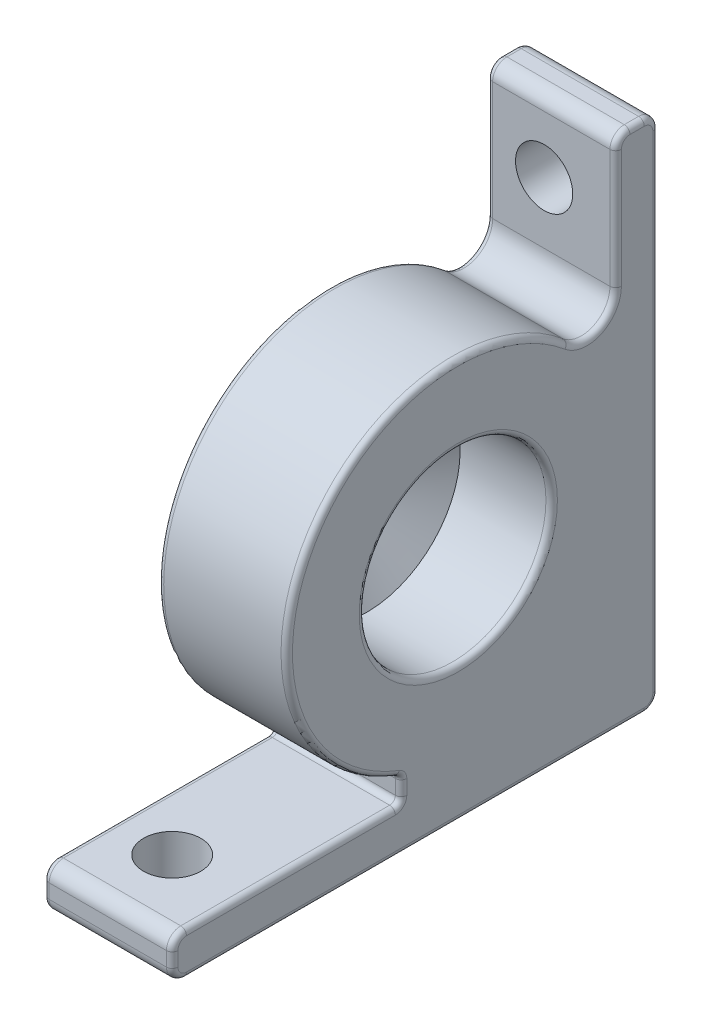
from build123d import *

# Parameters (mm, degrees)
EXTRUDE_1_DEPTH             = 4.5
SKETCH_2_R                  = 2
CUT_EXTRUDE_1_DEPTH         = 10
HOLE_WIZARD_5_16_18_1_D     = 6.5278
HOLE_WIZARD_5_16_18_1_DEPTH = 3.2
HOLE_WIZARD_5_16_18_1_TIP   = 1.961148974
CUT_EXTRUDE_2_REACH         = 21.812
SKETCH_5_R                  = 1
CUT_EXTRUDE_3_REACH         = 20.987
SKETCH_6_R                  = 1
FILLET_1_R                  = 0.2


with BuildPart() as part:
    # 草图1 → 凸台-拉伸1 (new body)
    with BuildSketch(Plane(origin=(0, 0, 0), x_dir=(0, 0, -1), z_dir=(1, 0, 0))):
        with BuildLine():
            Line((-9.5, -6.5), (-2.2, -6.5))
            ThreePointArc((-2.2, -6.5), (-2.058578644, -6.441421356), (-2, -6.3))
            Line((-2, -6.3), (-2, -5.791869158))
            ThreePointArc((-2, -5.791869158), (-2.035373795, -5.67829886), (-2.128982125, -5.604902686))
            ThreePointArc((-2.128982125, -5.604902686), (-5.170400988, 3.035531689), (3.856740666, 4.590539233))
            ThreePointArc((3.856740666, 4.590539233), (4.922339121, 4.449749704), (5.5, 5.356187605))
            Line((5.5, 5.356187605), (5.5, 9.5))
            ThreePointArc((5.5, 9.5), (5.646446609, 9.853553391), (6, 10))
            Line((6, 10), (6.5, 10))
            ThreePointArc((6.5, 10), (6.853553391, 9.853553391), (7, 9.5))
            Line((7, 9.5), (7, -7.5))
            ThreePointArc((7, -7.5), (6.853553391, -7.853553391), (6.5, -8))
            Line((6.5, -8), (-9.5, -8))
            ThreePointArc((-9.5, -8), (-9.853553391, -7.853553391), (-10, -7.5))
            Line((-10, -7.5), (-10, -7))
            ThreePointArc((-10, -7), (-9.853553391, -6.646446609), (-9.5, -6.5))
        make_face()
    extrude(amount=EXTRUDE_1_DEPTH)

    # 草图2 → 切除-拉伸1 (cut)
    with BuildSketch(Plane.ZY):
        Circle(SKETCH_2_R)
    extrude(amount=-CUT_EXTRUDE_1_DEPTH, mode=Mode.SUBTRACT)

    # 5/16-18 螺纹孔1
    with Locations(Plane(origin=(4.5, 0, 0), x_dir=(0, 0, -1), z_dir=(1, 0, 0))):
        with Locations((0, 0)):
            Hole(HOLE_WIZARD_5_16_18_1_D / 2, depth=HOLE_WIZARD_5_16_18_1_DEPTH)
            with Locations((0, 0, -(HOLE_WIZARD_5_16_18_1_DEPTH + HOLE_WIZARD_5_16_18_1_TIP / 2))):  # 118° drill point
                Cone(0, HOLE_WIZARD_5_16_18_1_D / 2, HOLE_WIZARD_5_16_18_1_TIP, mode=Mode.SUBTRACT)

    # 草图5 → 切除-拉伸2 (cut, up to next)
    with BuildSketch(Plane(origin=(0, -6.5, 0), x_dir=(1, 0, 0), z_dir=(0, 1, 0)), mode=Mode.PRIVATE) as cut_extrude_2_sk1:
        with Locations(Location((2, -7.5, 0), (0, 0, 270))):
            Circle(SKETCH_5_R)
    cut_extrude_2_tool1 = extrude(cut_extrude_2_sk1.sketch, amount=-CUT_EXTRUDE_2_REACH, mode=Mode.PRIVATE) & part.part
    add(cut_extrude_2_tool1.solids().sort_by_distance((2, -6.5, 7.5))[0], mode=Mode.SUBTRACT)

    # 草图6 → 切除-拉伸3 (cut, up to next)
    with BuildSketch(Plane.XY.offset(-5.5), mode=Mode.PRIVATE) as cut_extrude_3_sk1:
        with Locations((2, 7.5)):
            Circle(SKETCH_6_R)
    cut_extrude_3_tool1 = extrude(cut_extrude_3_sk1.sketch, amount=-CUT_EXTRUDE_3_REACH, mode=Mode.PRIVATE) & part.part
    add(cut_extrude_3_tool1.solids().sort_by_distance((2, 7.5, -5.5))[0], mode=Mode.SUBTRACT)

    # 圆角1
    fillet_1_edges = [part.edges().sort_by_distance(p)[0] for p in [
        (4.5, -6.646446609, 9.853553391),
        (4.5, -7.25, 10),
        (0, -6.441421356, 2.058578644),
        (0, -6.045934579, 2),
        (0, -5.67829886, 2.035373795),
        (0, 3.035531689, 5.170400988),
        (4.5, -7.853553391, 9.853553391),
        (0, 4.449749704, -4.922339121),
        (0, 7.428093802, -5.5),
        (0, 9.853553391, -5.646446609),
        (0, 10, -6.25),
        (0, 9.853553391, -6.853553391),
        (0, 1, -7),
        (0, -7.853553391, -6.853553391),
        (0, -8, 1.5),
        (4.5, -8, 1.5),
        (0, -7.853553391, 9.853553391),
        (0, -7.25, 10),
        (0, -6.646446609, 9.853553391),
        (0, -6.5, 5.85),
        (4.5, -7.853553391, -6.853553391),
        (4.5, 1, -7),
        (4.5, 9.853553391, -6.853553391),
        (4.5, 10, -6.25),
        (4.5, 9.853553391, -5.646446609),
        (4.5, 7.428093802, -5.5),
        (4.5, -6.5, 5.85),
        (4.5, 4.449749704, -4.922339121),
        (0, 0, -2),
        (4.5, 3.035531689, 5.170400988),
        (4.5, 0, -3.2639),
        (4.5, -5.67829886, 2.035373795),
        (4.5, -6.045934579, 2),
        (4.5, -6.441421356, 2.058578644),
    ]]
    fillet(fillet_1_edges, radius=FILLET_1_R)


solid = part.part
